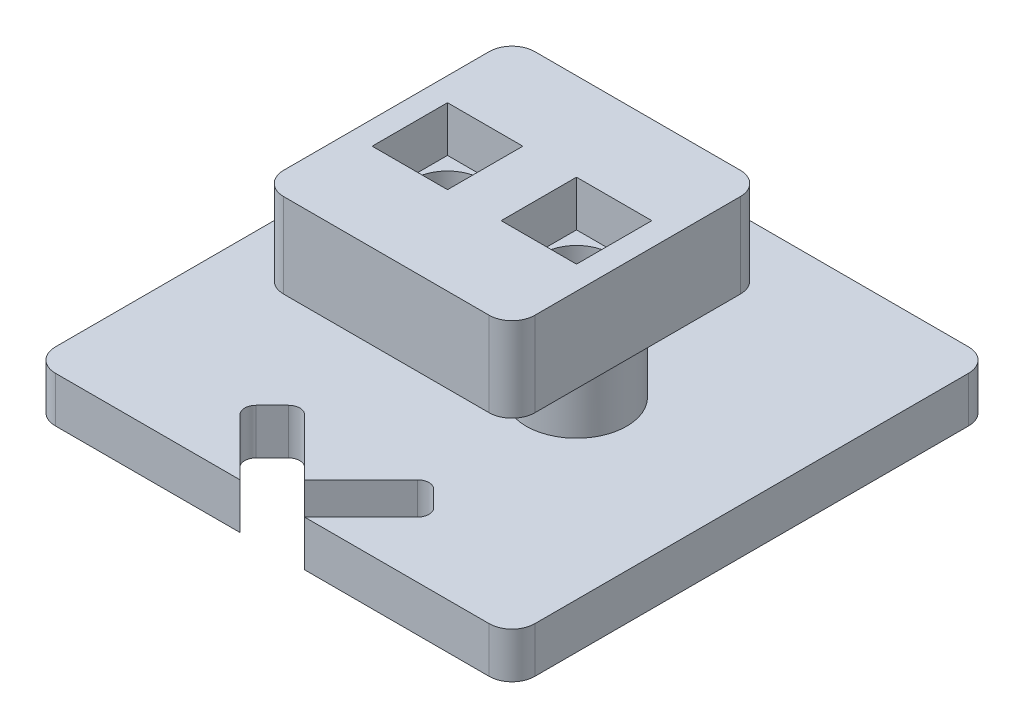
from build123d import *

# Parameters (mm, degrees)
SKETCH1_W           = 11
SKETCH1_H           = 11
BOSS_EXTRUDE1_DEPTH = 3.7
FILLET1_R           = 1
SKETCH2_W           = 3.3
SKETCH2_H           = 3.3
CUT_EXTRUDE1_DEPTH  = 2
SKETCH4_R           = 2.2
BOSS_EXTRUDE2_DEPTH = 5
BOSS_EXTRUDE3_DEPTH = 2
SKETCH3_R           = 1.5
CUT_EXTRUDE2_DEPTH  = 18.210171411
CUT_EXTRUDE3_DEPTH  = 17.290794947


with BuildPart() as part:
    # Sketch1 → Boss-Extrude1 (new body)
    with BuildSketch(Plane(origin=(0, 0, 0), x_dir=(1, 0, 0), z_dir=(0, 1, 0))):
        Rectangle(SKETCH1_W, SKETCH1_H)
    extrude(amount=BOSS_EXTRUDE1_DEPTH)

    # Fillet1
    fillet1_edges = [part.edges().sort_by_distance(p)[0] for p in [
        (5.5, 1.85, 5.5),
        (-5.5, 1.85, 5.5),
        (-5.5, 1.85, -5.5),
        (5.5, 1.85, -5.5),
    ]]
    fillet(fillet1_edges, radius=FILLET1_R)

    # Sketch2 → Cut-Extrude1 (cut)
    with BuildSketch(Plane(origin=(0, 3.7, 0), x_dir=(1, 0, 0), z_dir=(0, 1, 0))):
        with Locations((-2.825, 0)):
            Rectangle(SKETCH2_W, SKETCH2_H)
        with Locations((2.825, 0)):
            Rectangle(SKETCH2_W, SKETCH2_H)
    extrude(amount=-CUT_EXTRUDE1_DEPTH, mode=Mode.SUBTRACT)

    # Sketch4 → Boss-Extrude2 (add)
    with BuildSketch(Plane(origin=(0, 0, 0), x_dir=(-1, 0, 0), z_dir=(0, -1, 0))):
        with Locations(Location((2.825, 0, 0), (0, 0, 90))):
            Circle(SKETCH4_R)
        with Locations(Location((-2.825, 0, 0), (0, 0, 90))):
            Circle(SKETCH4_R)
    extrude(amount=BOSS_EXTRUDE2_DEPTH)

    # Sketch5 → Boss-Extrude3 (add)
    with BuildSketch(Plane(origin=(0, -5, 0), x_dir=(-1, 0, 0), z_dir=(0, -1, 0))):
        with BuildLine():
            Line((9.5, 10.5), (-9.5, 10.5))
            ThreePointArc((-9.5, 10.5), (-10.207106781, 10.207106781), (-10.5, 9.5))
            Line((-10.5, 9.5), (-10.5, -9.5))
            ThreePointArc((-10.5, -9.5), (-10.207106781, -10.207106781), (-9.5, -10.5))
            Line((-9.5, -10.5), (9.5, -10.5))
            ThreePointArc((9.5, -10.5), (10.207106781, -10.207106781), (10.5, -9.5))
            Line((10.5, -9.5), (10.5, 9.5))
            ThreePointArc((10.5, 9.5), (10.207106781, 10.207106781), (9.5, 10.5))
        make_face()
    extrude(amount=-BOSS_EXTRUDE3_DEPTH)

    # Sketch3 → Cut-Extrude2 (cut, through all)
    with BuildSketch(Plane(origin=(0, 3.7, 0), x_dir=(1, 0, 0), z_dir=(0, 1, 0))):
        with Locations(Location((-2.825, 0, 0), (0, 0, 270))):
            Circle(SKETCH3_R)
        with Locations(Location((2.825, 0, 0), (0, 0, 270))):
            Circle(SKETCH3_R)
    extrude(amount=-CUT_EXTRUDE2_DEPTH, mode=Mode.SUBTRACT)

    # Sketch7 → Cut-Extrude3 (cut, through all)
    with BuildSketch(Plane(origin=(0, -3, 0), x_dir=(1, 0, 0), z_dir=(0, 1, 0))):
        with BuildLine():
            Line((0, -9.085786438), (1.414213562, -10.5))
            Line((1.414213562, -10.5), (3.889087297, -8.025126266))
            ThreePointArc((3.889087297, -8.025126266), (4.035533906, -7.671572875), (3.889087297, -7.318019485))
            Line((3.889087297, -7.318019485), (3.181980515, -6.610912703))
            ThreePointArc((3.181980515, -6.610912703), (2.828427125, -6.464466094), (2.474873734, -6.610912703))
            Line((2.474873734, -6.610912703), (0, -9.085786438))
        make_face()
        with BuildLine():
            Line((-3.889087297, -8.025126266), (-1.414213562, -10.5))
            Line((-1.414213562, -10.5), (0, -9.085786438))
            Line((0, -9.085786438), (-2.474873734, -6.610912703))
            ThreePointArc((-2.474873734, -6.610912703), (-2.828427125, -6.464466094), (-3.181980515, -6.610912703))
            Line((-3.181980515, -6.610912703), (-3.889087297, -7.318019485))
            ThreePointArc((-3.889087297, -7.318019485), (-4.035533906, -7.671572875), (-3.889087297, -8.025126266))
        make_face()
        Polygon((-1.414213562, -10.5), (1.414213562, -10.5), (0, -9.085786438), align=None)
    extrude(amount=-CUT_EXTRUDE3_DEPTH, mode=Mode.SUBTRACT)


solid = part.part
